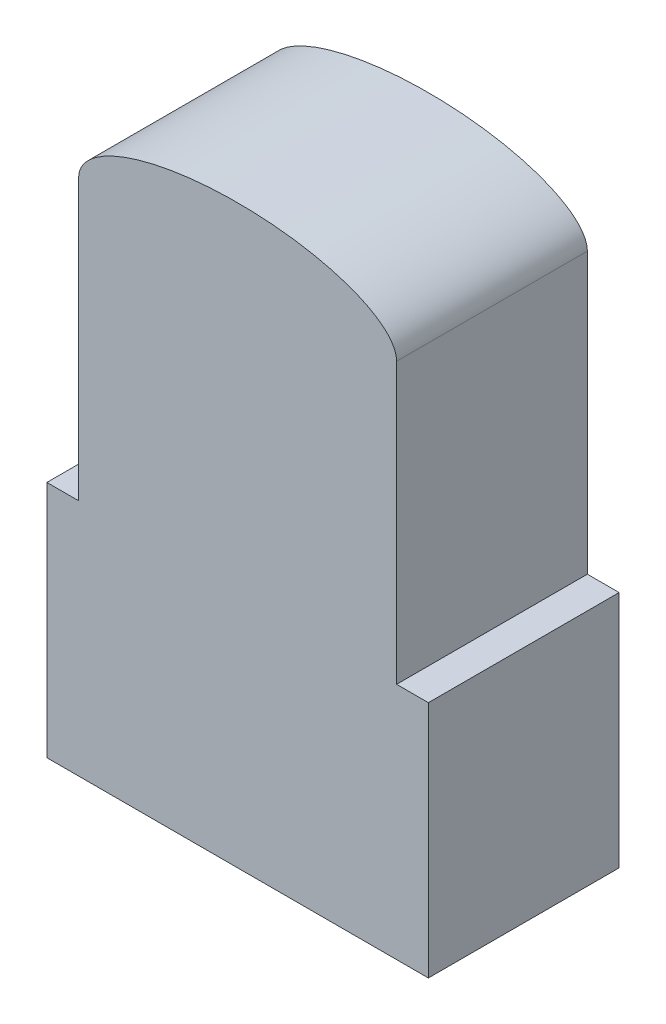
from build123d import *

# Parameters (mm, degrees)
SALIENTE_EXTRUIR1_DEPTH = 3


with BuildPart() as part:
    # Model → Saliente-Extruir1 (new body)
    with BuildSketch(Plane.XY):
        with BuildLine():
            Line((175.378683827, 141.535608421), (175.378683827, 137.135608421))
            Line((175.378683827, 137.135608421), (174.878683827, 137.135608421))
            Line((174.878683827, 137.135608421), (174.878683827, 133.385608421))
            Line((174.878683827, 133.385608421), (180.878683827, 133.385608421))
            Line((180.878683827, 133.385608421), (180.878683827, 137.135608421))
            Line((180.878683827, 137.135608421), (180.378683827, 137.135608421))
            Line((180.378683827, 137.135608421), (180.378683827, 141.535608421))
            add(Edge.make_bspline(
                [(180.378683827, 141.535608421), (180.378683827, 142.44509563), (177.878683827, 142.44509563), (175.378683827, 142.44509563), (175.378683827, 141.535608421)],
                knots=[0, 0, 0, 1.570796327, 1.570796327, 3.141592654, 3.141592654, 3.141592654], degree=2, weights=[1, 0.707106781, 1, 0.707106781, 1]))
        make_face()
    extrude(amount=SALIENTE_EXTRUIR1_DEPTH)


solid = part.part
